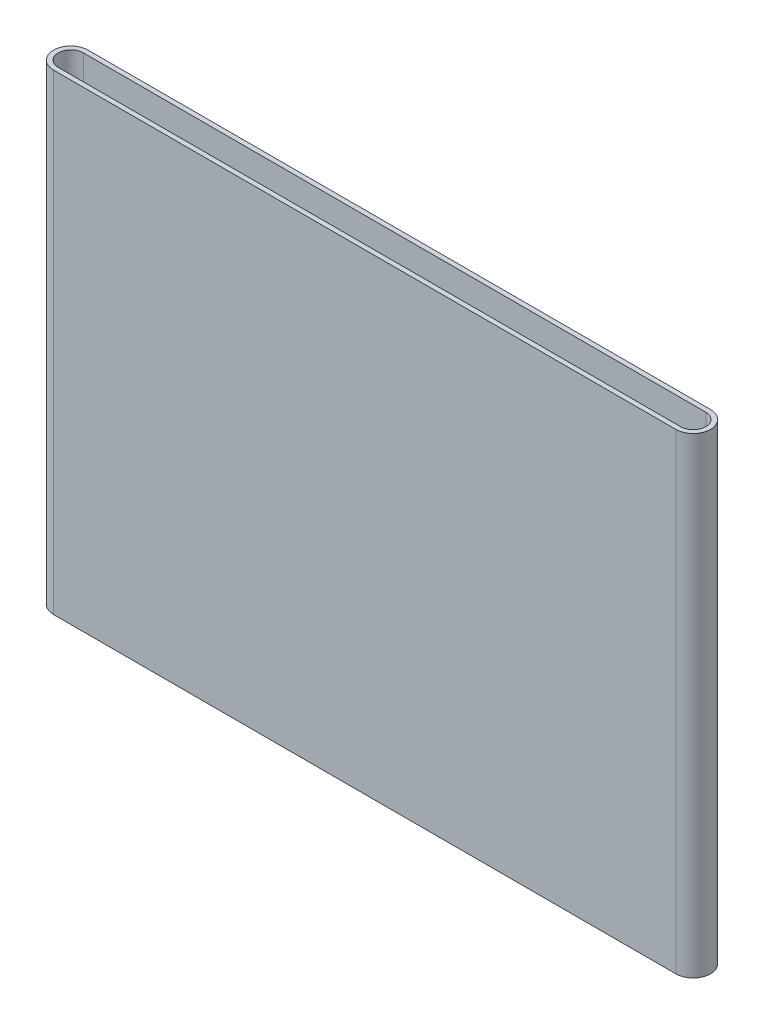
from build123d import *

# Parameters (mm, degrees)
EXTRUDE_1_DEPTH = 150


with BuildPart() as part:
    # 草图1 → 凸台-拉伸1 (new body)
    with BuildSketch(Plane(origin=(0, 0, 0), x_dir=(1, 0, 0), z_dir=(0, 1, 0))):
        with BuildLine():
            Line((-99, -5.5), (99, -5.5))
            ThreePointArc((99, -5.5), (104.5, 0), (99, 5.5))
            Line((99, 5.5), (-99, 5.5))
            ThreePointArc((-99, 5.5), (-104.5, 0), (-99, -5.5))
        make_face()
        with BuildLine():
            Line((-99, 4), (99, 4))
            ThreePointArc((99, 4), (103, 0), (99, -4))
            Line((99, -4), (-99, -4))
            ThreePointArc((-99, -4), (-103, 0), (-99, 4))
        make_face(mode=Mode.SUBTRACT)
    extrude(amount=EXTRUDE_1_DEPTH)


solid = part.part
